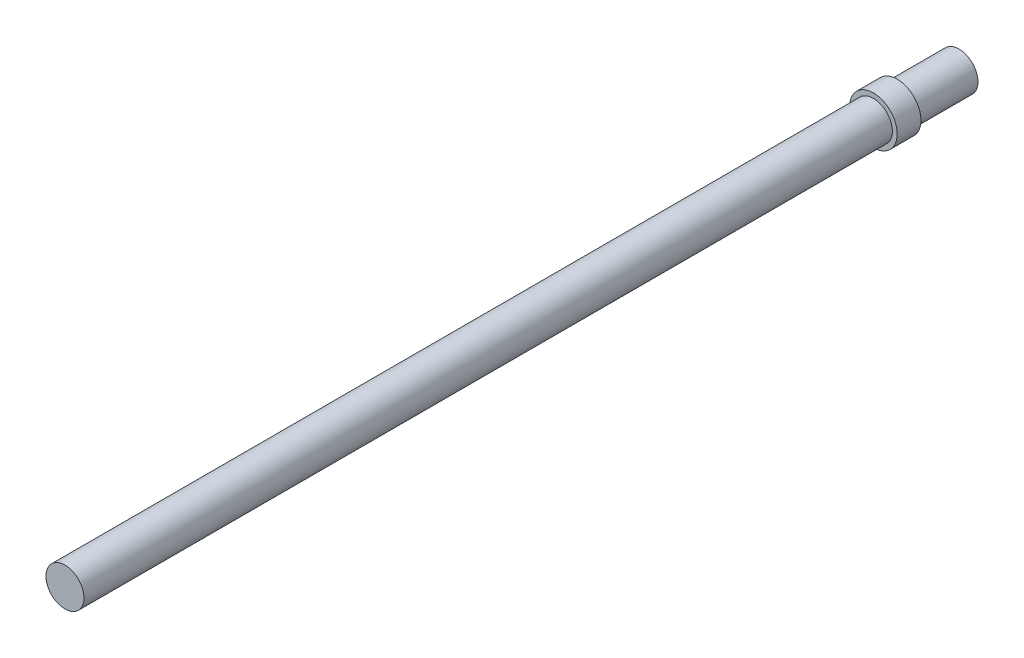
from build123d import *

# Parameters (mm, degrees)
SKETCH1_R           = 4
BOSS_EXTRUDE1_DEPTH = 170
SKETCH2_R           = 5
BOSS_EXTRUDE2_DEPTH = 5
BOSS_EXTRUDE3_START = -18
SKETCH3_R           = 4
BOSS_EXTRUDE3_DEPTH = 18


with BuildPart() as part:
    # Sketch1 → Boss-Extrude1 (new body)
    with BuildSketch(Plane.XY):
        Circle(SKETCH1_R)
    extrude(amount=BOSS_EXTRUDE1_DEPTH)

    # Sketch2 → Boss-Extrude2 (add)
    with BuildSketch(Plane.XY):
        Circle(SKETCH2_R)
    extrude(amount=-BOSS_EXTRUDE2_DEPTH)

    # Sketch3 → Boss-Extrude3 (add)
    with BuildSketch(Plane.XY.offset(BOSS_EXTRUDE3_START)):
        Circle(SKETCH3_R)
    extrude(amount=BOSS_EXTRUDE3_DEPTH)


solid = part.part
